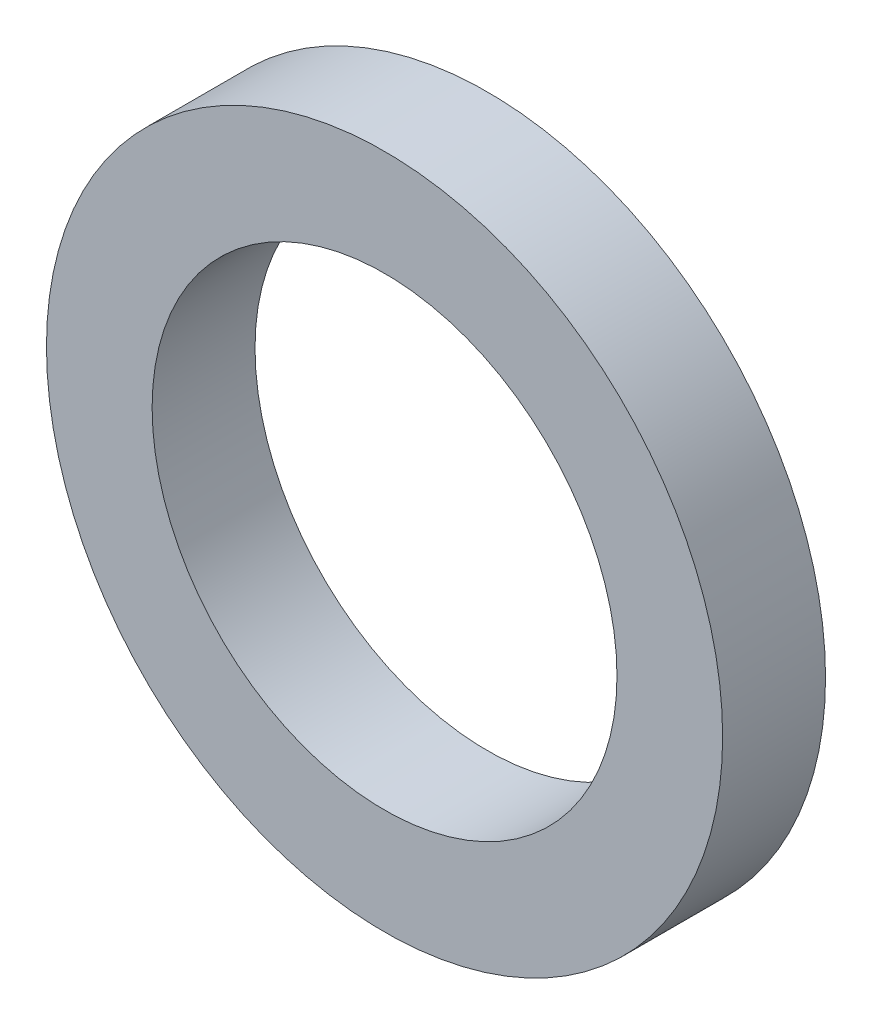
from build123d import *

# Parameters (mm, degrees)
SKETCH1_R           = 9.2
SKETCH1_R_2         = 6.325
BOSS_EXTRUDE1_DEPTH = 2.8


with BuildPart() as part:
    # Sketch1 → Boss-Extrude1 (new body)
    with BuildSketch(Plane.XY):
        Circle(SKETCH1_R)
        Circle(SKETCH1_R_2, mode=Mode.SUBTRACT)
    extrude(amount=BOSS_EXTRUDE1_DEPTH)


solid = part.part
